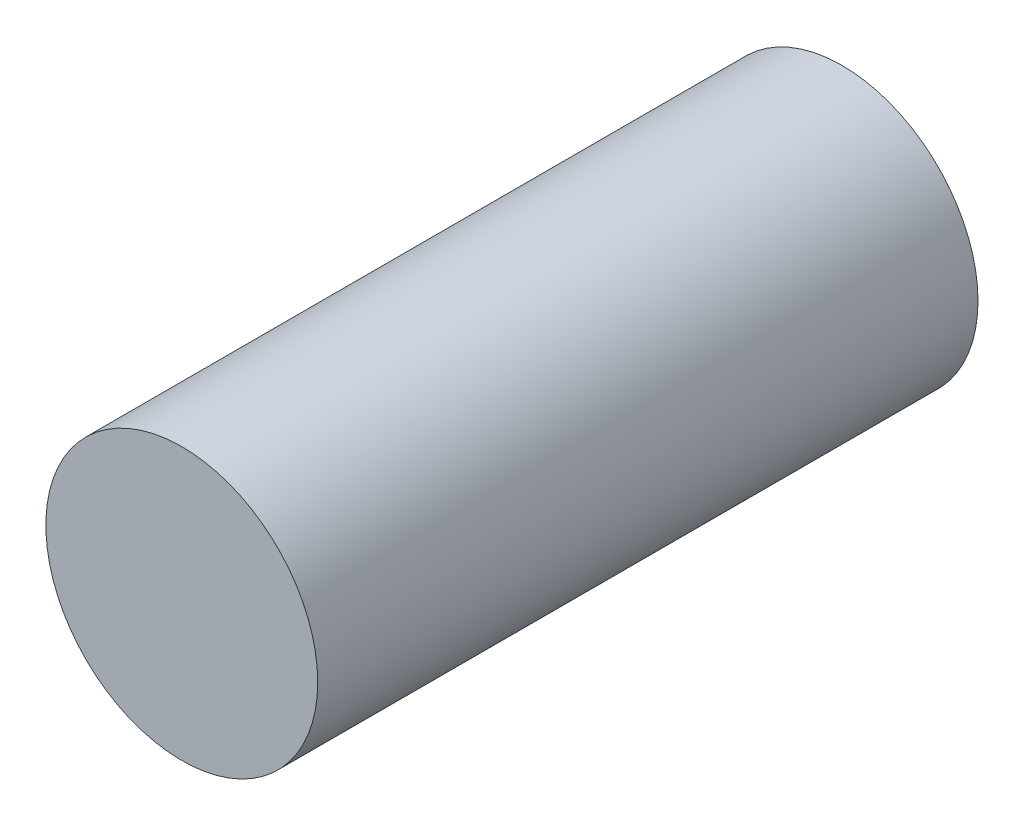
from build123d import *

# Parameters (mm, degrees)
SKETCH_1_R      = 3.5
EXTRUDE_1_DEPTH = 17


with BuildPart() as part:
    # 草图1 → 凸台-拉伸1 (new body)
    with BuildSketch(Plane.XY):
        Circle(SKETCH_1_R)
    extrude(amount=EXTRUDE_1_DEPTH)


solid = part.part
